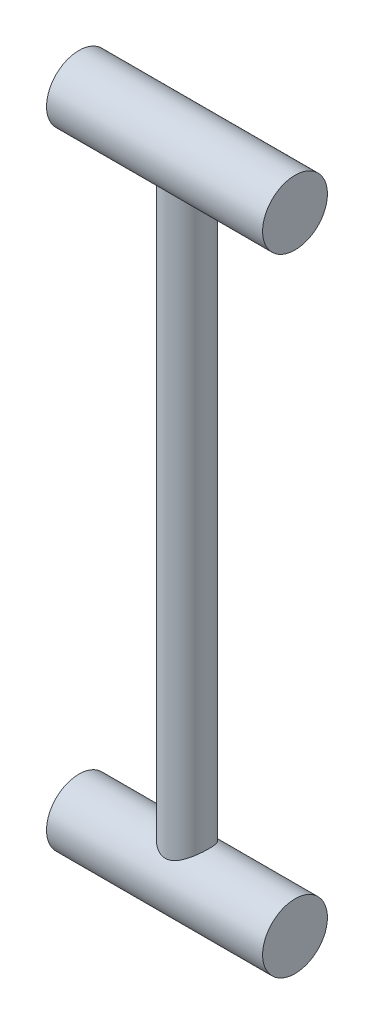
from build123d import *

# Parameters (mm, degrees)
SKETCH1_W           = 10
SKETCH1_H           = 290
SKETCH2_R           = 15
BOSS_EXTRUDE1_DEPTH = 50


with BuildPart() as part:
    # Sketch1 → Revolve1 (revolve)
    with BuildSketch(Plane.XY, mode=Mode.PRIVATE) as revolve1_sk:
        with Locations((-5, 0)):
            Rectangle(SKETCH1_W, SKETCH1_H)
    revolve(revolve1_sk.sketch.rotate(Axis((0, 145, 0), (0, -1, 0)), 270), axis=Axis((0, 145, 0), (0, -1, 0)))

    # Sketch2 → Boss-Extrude1 (add, symmetric)
    with BuildSketch(Plane(origin=(0, 0, 0), x_dir=(0, 0, -1), z_dir=(1, 0, 0))):
        with Locations((0, 145)):
            Circle(SKETCH2_R)
    boss_extrude1 = extrude(amount=BOSS_EXTRUDE1_DEPTH, both=True)

    # Mirror1: Boss-Extrude1 across plane
    add(boss_extrude1.mirror(Plane.ZX))


solid = part.part
